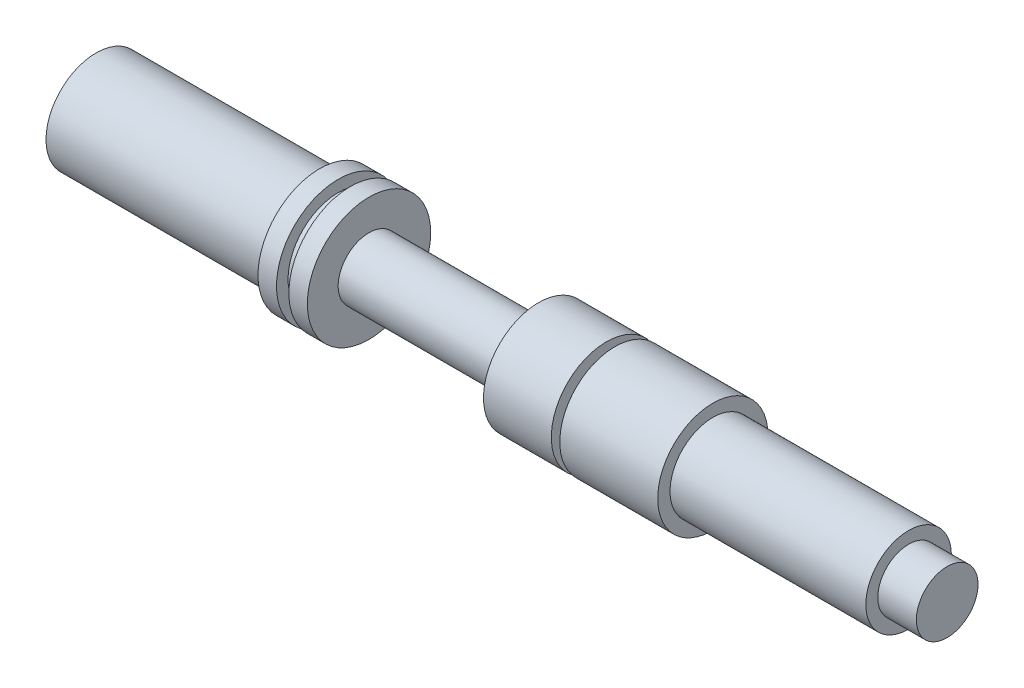
from build123d import *

# Parameters (mm, degrees)
SKETCH_1_R       = 6.5
EXTRUDE_1_DEPTH  = 29
SKETCH_2_R       = 8
EXTRUDE_2_DEPTH  = 2.4
SKETCH_3_R       = 6.5
EXTRUDE_3_DEPTH  = 1.6
SKETCH_4_R       = 8
EXTRUDE_4_DEPTH  = 2.4
SKETCH_5_R       = 4
EXTRUDE_5_DEPTH  = 22
SKETCH_6_R       = 7.15
EXTRUDE_6_DEPTH  = 8.8
SKETCH_7_R       = 5.55
EXTRUDE_7_DEPTH  = 1.1
SKETCH_8_R       = 7.15
EXTRUDE_8_DEPTH  = 12.7
SKETCH_9_R       = 5.55
EXTRUDE_9_DEPTH  = 25.4
SKETCH_10_R      = 4
EXTRUDE_10_DEPTH = 5


with BuildPart() as part:
    # Эскиз1 → Бобышка-Вытянуть1 (new body)
    with BuildSketch(Plane(origin=(0, 0, 0), x_dir=(0, 0, -1), z_dir=(1, 0, 0))):
        with Locations(Location((0, 0, 0), (0, 0, 180))):
            Circle(SKETCH_1_R)
    extrude(amount=EXTRUDE_1_DEPTH)

    # Эскиз2 → Бобышка-Вытянуть2 (add)
    with BuildSketch(Plane(origin=(29, 0, 0), x_dir=(0, 0, -1), z_dir=(1, 0, 0))):
        Circle(SKETCH_2_R)
    extrude(amount=EXTRUDE_2_DEPTH)

    # Эскиз3 → Бобышка-Вытянуть3 (add)
    with BuildSketch(Plane(origin=(31.4, 0, 0), x_dir=(0, 0, -1), z_dir=(1, 0, 0))):
        with Locations(Location((0, 0, 0), (0, 0, 180))):
            Circle(SKETCH_3_R)
    extrude(amount=EXTRUDE_3_DEPTH)

    # Эскиз4 → Бобышка-Вытянуть4 (add)
    with BuildSketch(Plane(origin=(33, 0, 0), x_dir=(0, 0, -1), z_dir=(1, 0, 0))):
        Circle(SKETCH_4_R)
    extrude(amount=EXTRUDE_4_DEPTH)

    # Эскиз5 → Бобышка-Вытянуть5 (add)
    with BuildSketch(Plane(origin=(35.4, 0, 0), x_dir=(0, 0, -1), z_dir=(1, 0, 0))):
        Circle(SKETCH_5_R)
    extrude(amount=EXTRUDE_5_DEPTH)

    # Эскиз6 → Бобышка-Вытянуть6 (add)
    with BuildSketch(Plane(origin=(57.4, 0, 0), x_dir=(0, 0, -1), z_dir=(1, 0, 0))):
        Circle(SKETCH_6_R)
    extrude(amount=EXTRUDE_6_DEPTH)

    # Эскиз7 → Бобышка-Вытянуть7 (add)
    with BuildSketch(Plane(origin=(66.2, 0, 0), x_dir=(0, 0, -1), z_dir=(1, 0, 0))):
        Circle(SKETCH_7_R)
    extrude(amount=EXTRUDE_7_DEPTH)

    # Эскиз8 → Бобышка-Вытянуть8 (add)
    with BuildSketch(Plane(origin=(67.3, 0, 0), x_dir=(0, 0, -1), z_dir=(1, 0, 0))):
        Circle(SKETCH_8_R)
    extrude(amount=EXTRUDE_8_DEPTH)

    # Эскиз9 → Бобышка-Вытянуть9 (add)
    with BuildSketch(Plane(origin=(80, 0, 0), x_dir=(0, 0, -1), z_dir=(1, 0, 0))):
        Circle(SKETCH_9_R)
    extrude(amount=EXTRUDE_9_DEPTH)

    # Эскиз10 → Бобышка-Вытянуть10 (add)
    with BuildSketch(Plane(origin=(105.4, 0, 0), x_dir=(0, 0, -1), z_dir=(1, 0, 0))):
        Circle(SKETCH_10_R)
    extrude(amount=EXTRUDE_10_DEPTH)


solid = part.part
